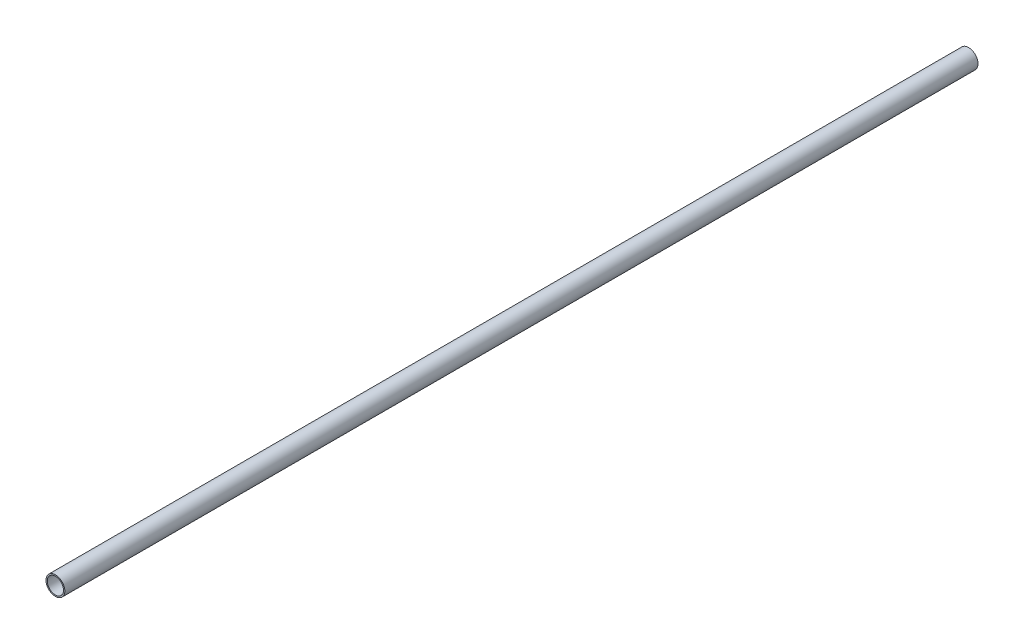
from build123d import *

# Parameters (mm, degrees)
SKETCH1_R           = 7.25
SKETCH1_R_2         = 6.25
BOSS_EXTRUDE1_DEPTH = 703


with BuildPart() as part:
    # Sketch1 → Boss-Extrude1 (new body)
    with BuildSketch(Plane.XY):
        Circle(SKETCH1_R)
        Circle(SKETCH1_R_2, mode=Mode.SUBTRACT)
    extrude(amount=BOSS_EXTRUDE1_DEPTH)


solid = part.part
